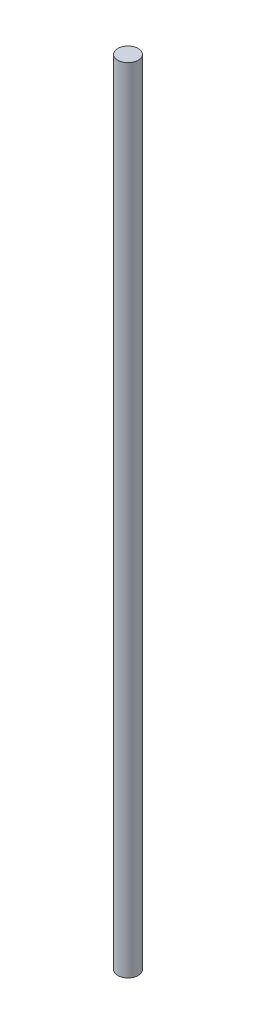
from build123d import *

# Parameters (mm, degrees)
SKETCH1_R           = 4
BOSS_EXTRUDE1_DEPTH = 155


with BuildPart() as part:
    # Sketch1 → Boss-Extrude1 (new, symmetric)
    with BuildSketch(Plane(origin=(0, 0, 0), x_dir=(1, 0, 0), z_dir=(0, 1, 0))):
        with Locations(Location((0, 0, 0), (0, 0, 270))):
            Circle(SKETCH1_R)
    extrude(amount=BOSS_EXTRUDE1_DEPTH, both=True)


solid = part.part
